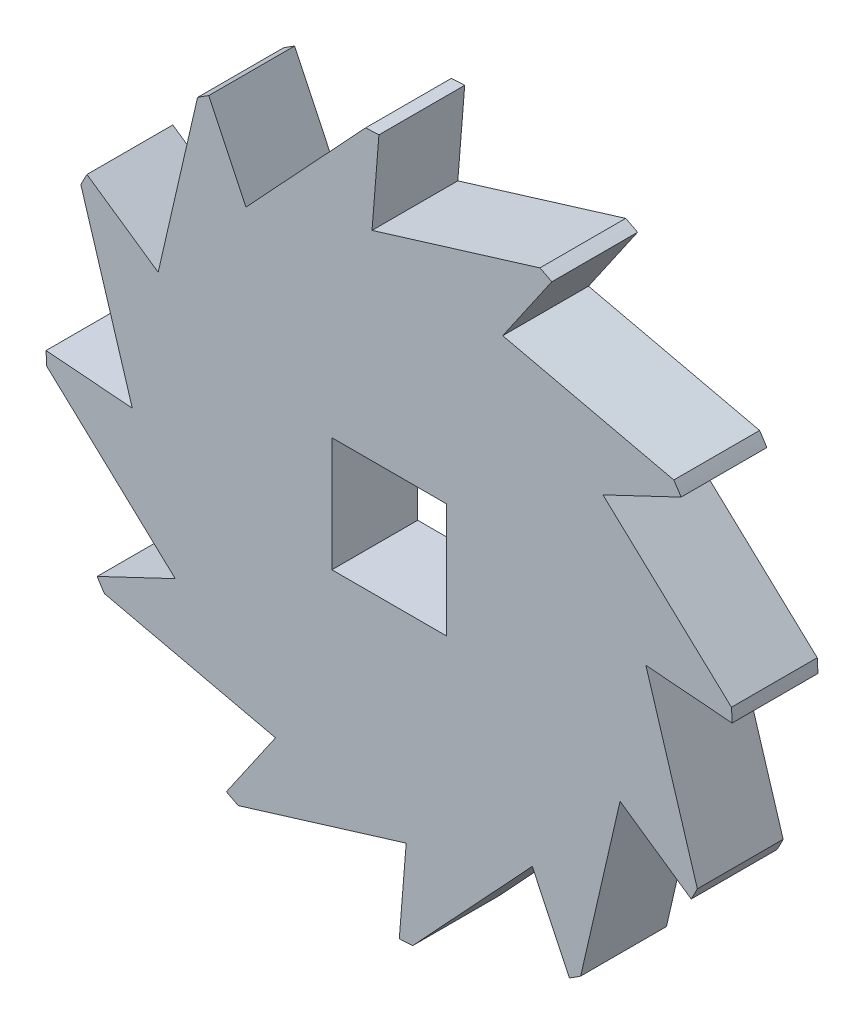
from build123d import *

# Parameters (mm, degrees)
SKETCH1_W           = 10
SKETCH1_H           = 10
BOSS_EXTRUDE1_DEPTH = 7.5


with BuildPart() as part:
    # Sketch1 → Boss-Extrude1 (new body)
    with BuildSketch(Plane.XY):
        with BuildLine():
            Line((-1.493748368, 22.45), (-0.89, 29.986795427))
            ThreePointArc((-0.89, 29.986795427), (-1.473994911, 29.963767103), (-2.057430392, 29.929366518))
            Line((-2.057430392, 29.929366518), (-12.518624033, 18.695396131))
            Line((-12.518624033, 18.695396131), (-15.764160323, 25.524326618))
            ThreePointArc((-15.764160323, 25.524326618), (-16.25840059, 25.212386049), (-16.746470245, 24.890876528))
            Line((-16.746470245, 24.890876528), (-20.189144499, 9.931375967))
            Line((-20.189144499, 9.931375967), (-26.414326618, 14.222635104))
            ThreePointArc((-26.414326618, 14.222635104), (-26.68638096, 13.705366513), (-26.94830692, 13.182896273))
            Line((-26.94830692, 13.182896273), (-22.45, -1.493748368))
            Line((-22.45, -1.493748368), (-29.986795427, -0.89))
            ThreePointArc((-29.986795427, -0.89), (-29.963767103, -1.473994912), (-29.929366518, -2.057430392))
            Line((-29.929366518, -2.057430392), (-18.695396131, -12.518624033))
            Line((-18.695396131, -12.518624033), (-25.524326618, -15.764160323))
            ThreePointArc((-25.524326618, -15.764160323), (-25.212386048, -16.25840059), (-24.890876528, -16.746470245))
            Line((-24.890876528, -16.746470245), (-9.931375967, -20.189144499))
            Line((-9.931375967, -20.189144499), (-14.222635104, -26.414326618))
            ThreePointArc((-14.222635104, -26.414326618), (-13.705366513, -26.68638096), (-13.182896273, -26.94830692))
            Line((-13.182896273, -26.94830692), (1.493748368, -22.45))
            Line((1.493748368, -22.45), (0.89, -29.986795427))
            ThreePointArc((0.89, -29.986795427), (1.473994912, -29.963767103), (2.057430392, -29.929366518))
            Line((2.057430392, -29.929366518), (12.518624033, -18.695396131))
            Line((12.518624033, -18.695396131), (15.764160323, -25.524326618))
            ThreePointArc((15.764160323, -25.524326618), (16.25840059, -25.212386048), (16.746470245, -24.890876528))
            Line((16.746470245, -24.890876528), (20.189144499, -9.931375967))
            Line((20.189144499, -9.931375967), (26.414326618, -14.222635104))
            ThreePointArc((26.414326618, -14.222635104), (26.68638096, -13.705366513), (26.94830692, -13.182896273))
            Line((26.94830692, -13.182896273), (22.45, 1.493748368))
            Line((22.45, 1.493748368), (29.986795427, 0.89))
            ThreePointArc((29.986795427, 0.89), (29.963767103, 1.473994912), (29.929366518, 2.057430392))
            Line((29.929366518, 2.057430392), (18.695396131, 12.518624033))
            Line((18.695396131, 12.518624033), (25.524326618, 15.764160323))
            ThreePointArc((25.524326618, 15.764160323), (25.212386049, 16.25840059), (24.890876528, 16.746470245))
            Line((24.890876528, 16.746470245), (9.931375967, 20.189144499))
            Line((9.931375967, 20.189144499), (14.222635104, 26.414326618))
            ThreePointArc((14.222635104, 26.414326618), (13.705366513, 26.68638096), (13.182896273, 26.94830692))
            Line((13.182896273, 26.94830692), (-1.493748368, 22.45))
        make_face()
        Rectangle(SKETCH1_W, SKETCH1_H, mode=Mode.SUBTRACT)
    extrude(amount=BOSS_EXTRUDE1_DEPTH)


solid = part.part
